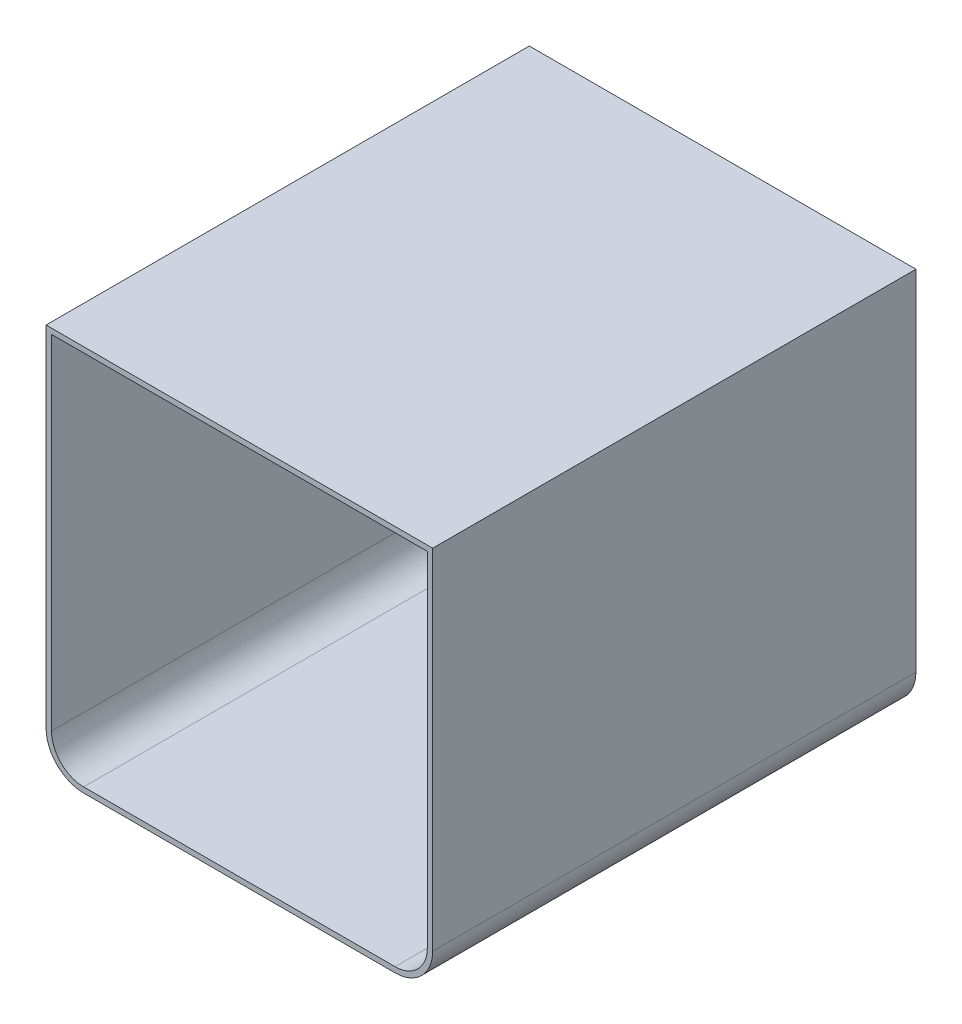
from build123d import *

# Parameters (mm, degrees)
BOSS_EXTRUDE1_DEPTH = 180


with BuildPart() as part:
    # Sketch1 → Boss-Extrude1 (new body)
    with BuildSketch(Plane.XY):
        with BuildLine():
            Line((-58, -72), (58, -72))
            ThreePointArc((58, -72), (67.899494937, -67.899494937), (72, -58))
            Line((72, -58), (72, 72))
            Line((72, 72), (-72, 72))
            Line((-72, 72), (-72, -58))
            ThreePointArc((-72, -58), (-67.899494937, -67.899494937), (-58, -72))
        make_face()
        with BuildLine():
            Line((-70, -58), (-70, 70))
            Line((-70, 70), (70, 70))
            Line((70, 70), (70, -58))
            ThreePointArc((70, -58), (66.485281374, -66.485281374), (58, -70))
            Line((58, -70), (-58, -70))
            ThreePointArc((-58, -70), (-66.485281374, -66.485281374), (-70, -58))
        make_face(mode=Mode.SUBTRACT)
    extrude(amount=BOSS_EXTRUDE1_DEPTH)


solid = part.part
